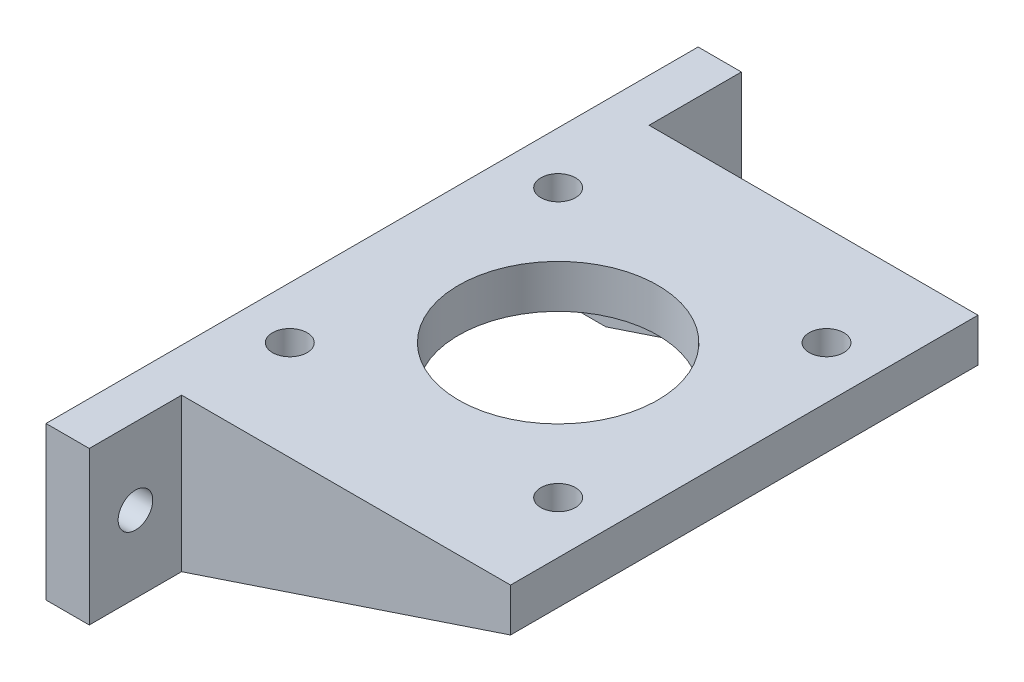
from build123d import *

# Parameters (mm, degrees)
SKETCH1_W           = 5
SKETCH1_H           = 5
SKETCH1_W_2         = 38
BOSS_EXTRUDE1_DEPTH = 44
SKETCH2_R           = 11.5
SKETCH2_R_2         = 2
CUT_EXTRUDE1_DEPTH  = 62.725197448
SKETCH1_3_W         = 38
SKETCH1_3_H         = 5
SKETCH1_3_W_2       = 5
SKETCH1_3_H_2       = 12.666
BOSS_EXTRUDE2_DEPTH = 5
BOSS_EXTRUDE3_START = -44
SKETCH1_4_W         = 5
SKETCH1_4_H         = 5
SKETCH1_4_H_2       = 12.666
SKETCH1_4_W_2       = 38
BOSS_EXTRUDE3_DEPTH = 5
SKETCH3_W           = 10.666
SKETCH3_H           = 17.666
SKETCH3_R           = 2
BOSS_EXTRUDE4_DEPTH = 5


with BuildPart() as part:
    # Sketch1 → Boss-Extrude1 (new body)
    with BuildSketch(Plane.XY):
        with Locations((2.5, 2.5)):
            Rectangle(SKETCH1_W, SKETCH1_H)
        with Locations((24, 2.5)):
            Rectangle(SKETCH1_W_2, SKETCH1_H)
    extrude(amount=-BOSS_EXTRUDE1_DEPTH)

    # Sketch2 → Cut-Extrude1 (cut, through all)
    with BuildSketch(Plane(origin=(0, 5, 0), x_dir=(1, 0, 0), z_dir=(0, 1, 0))):
        with Locations(Location((21.5, 22, 0), (0, 0, 270))):
            Circle(SKETCH2_R)
        with Locations(Location((37, 37.5, 0), (0, 0, 270))):
            Circle(SKETCH2_R_2)
        with Locations(Location((6, 37.5, 0), (0, 0, 270))):
            Circle(SKETCH2_R_2)
        with Locations(Location((6, 6.5, 0), (0, 0, 270))):
            Circle(SKETCH2_R_2)
        with Locations(Location((37, 6.5, 0), (0, 0, 270))):
            Circle(SKETCH2_R_2)
    extrude(amount=-CUT_EXTRUDE1_DEPTH, mode=Mode.SUBTRACT)

    # Sketch1<3> → Boss-Extrude2 (add)
    with BuildSketch(Plane.XY):
        Polygon((5, 0), (5, -12.666), (43, 0), align=None)
        with Locations((24, 2.5)):
            Rectangle(SKETCH1_3_W, SKETCH1_3_H)
        with Locations((2.5, 2.5)):
            Rectangle(SKETCH1_3_W_2, SKETCH1_3_H)
        with Locations((2.5, -6.333)):
            Rectangle(SKETCH1_3_W_2, SKETCH1_3_H_2)
    extrude(amount=BOSS_EXTRUDE2_DEPTH)

    # Sketch1<4> → Boss-Extrude3 (add)
    with BuildSketch(Plane.XY.offset(BOSS_EXTRUDE3_START)):
        with Locations((2.5, 2.5)):
            Rectangle(SKETCH1_4_W, SKETCH1_4_H)
        with Locations((2.5, -6.333)):
            Rectangle(SKETCH1_4_W, SKETCH1_4_H_2)
        Polygon((5, 0), (5, -12.666), (43, 0), align=None)
        with Locations((24, 2.5)):
            Rectangle(SKETCH1_4_W_2, SKETCH1_4_H)
    extrude(amount=-BOSS_EXTRUDE3_DEPTH)

    # Sketch3 → Boss-Extrude4 (add)
    # profile 1 of 2: a face of its own
    with BuildSketch(Plane.ZY):
        with Locations((10.333, -3.833)):
            Rectangle(SKETCH3_W, SKETCH3_H)
        with Locations((10.333, -3.833)):
            Circle(SKETCH3_R, mode=Mode.SUBTRACT)
    # profile 2 of 2: a face of its own
    with BuildSketch(Plane.ZY):
        with Locations((-54.333, -3.833)):
            Rectangle(SKETCH3_W, SKETCH3_H)
        with Locations(Location((-54.333, -3.833, 0), (0, 0, 180))):
            Circle(SKETCH3_R, mode=Mode.SUBTRACT)
    extrude(amount=-BOSS_EXTRUDE4_DEPTH)


solid = part.part
